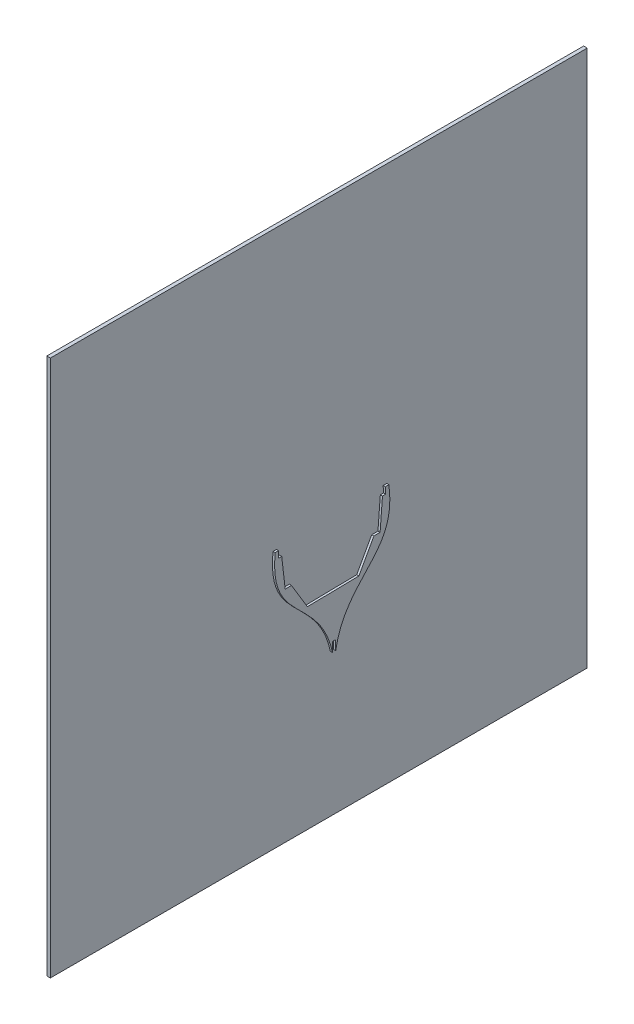
from build123d import *

# Parameters (mm, degrees)
BOSS_EXTRU_2_DEPTH      = 10
BOSS_EXTRU_3_DEPTH      = 6
ENL_V_MAT_EXTRU_1_DEPTH = 6


with BuildPart() as part:
    # Esquisse3D1 → Boss.-Extru.2 (new body)
    with BuildSketch(Plane(origin=(-20, 1121.289346724, 777.274991403), x_dir=(0, -0.7071067811865476, -0.7071067811865476), z_dir=(1, 0, 0))):
        Polygon((0, 0), (1060.66017178, 1060.66017178), (2121.32034356, 0), (1060.66017178, -1060.66017178), align=None)
    extrude(amount=BOSS_EXTRU_2_DEPTH)


with BuildPart() as body_2:
    # Esquisse5 → Boss.-Extru.3 (new body)
    with BuildSketch(Plane(origin=(0, 0, 0), x_dir=(0, 0, -1), z_dir=(1, 0, 0))):
        with BuildLine():
            Line((152.489493697, 358.048725483), (142.489493697, 357.86757171))
            Line((142.489493697, 357.86757171), (143.625333465, 339.446305755))
            Line((143.625333465, 339.446305755), (134.602488793, 339.282853519))
            Line((134.602488793, 339.282853519), (128.010290223, 254.940205779))
            Line((128.010290223, 254.940205779), (110.594025777, 254.624703578))
            Line((110.594025777, 254.624703578), (68.700493155, 179.102765817))
            Line((68.700493155, 179.102765817), (-75.142317047, 176.496999044))
            Line((-75.142317047, 176.496999044), (-119.743681695, 250.452049111))
            Line((-119.743681695, 250.452049111), (-137.159946142, 250.13654691))
            Line((-137.159946142, 250.13654691), (-146.80261473, 334.185093907))
            Line((-146.80261473, 334.185093907), (-155.825459402, 334.021641672))
            Line((-155.825459402, 334.021641672), (-155.357562292, 352.471959926))
            Line((-155.357562292, 352.471959926), (-165.357562292, 352.290806154))
            add(Edge.make_bspline(
                [(0, 0), (-4.612294832, 18.064961959), (-8.755298633, 210.423165767), (-186.058304211, 144.442522753), (-165.357562292, 352.290806154)],
                knots=[0, 0, 0, 0, 0, 1, 1, 1, 1, 1], degree=4))
            add(Edge.make_bspline(
                [(0, 0), (3.954976136, 18.220161304), (1.128265112, 210.602210253), (180.704683158, 151.086572632), (152.489493697, 358.048725483)],
                knots=[0, 0, 0, 0, 0, 1, 1, 1, 1, 1], degree=4))
        make_face()
    extrude(amount=BOSS_EXTRU_3_DEPTH)

    # Esquisse6 → Enlèv. mat.-Extru.1 (cut)
    with BuildSketch(Plane(origin=(6, 0, 0), x_dir=(0, 0, -1), z_dir=(1, 0, 0))):
        Polygon((-5.051813603, 30.379541318), (-5.540928789, 57.379541318), (3.459071211, 57.542579714), (3.948186397, 30.542579714), (117.063261114, -47.52702125), (-85.227699586, -65.220017949), align=None)
    extrude(amount=-ENL_V_MAT_EXTRU_1_DEPTH, mode=Mode.SUBTRACT)


solid = Compound([part.part, body_2.part])
